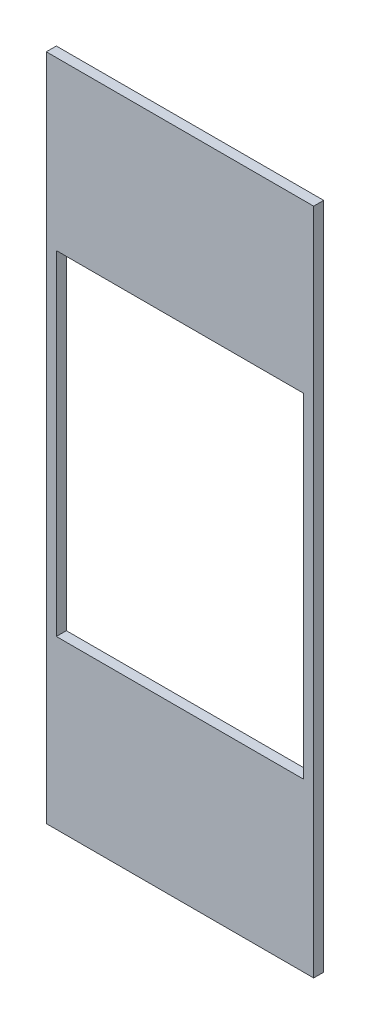
from build123d import *

# Parameters (mm, degrees)
SKETCH1_W           = 40
SKETCH1_H           = 100
BOSS_EXTRUDE1_DEPTH = 1.5
SKETCH2_W           = 37
SKETCH2_H           = 50
CUT_EXTRUDE1_DEPTH  = 1.5


with BuildPart() as part:
    # Sketch1 → Boss-Extrude1 (new body)
    with BuildSketch(Plane.XY):
        Rectangle(SKETCH1_W, SKETCH1_H)
    extrude(amount=BOSS_EXTRUDE1_DEPTH)

    # Sketch2 → Cut-Extrude1 (cut)
    with BuildSketch(Plane.XY.offset(1.5)):
        Rectangle(SKETCH2_W, SKETCH2_H)
    extrude(amount=-CUT_EXTRUDE1_DEPTH, mode=Mode.SUBTRACT)


solid = part.part
